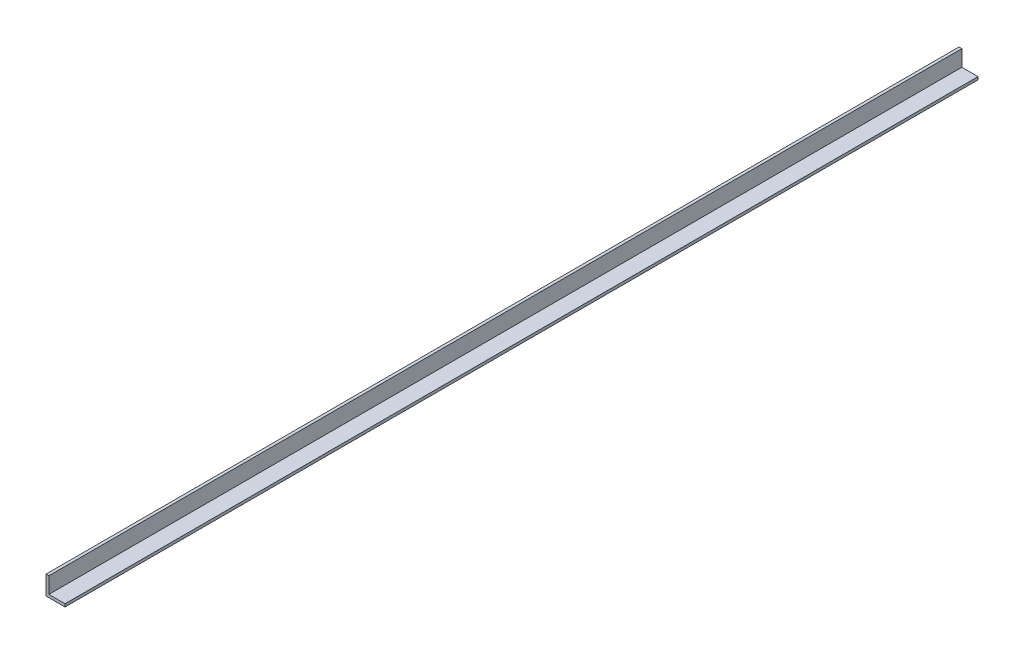
from build123d import *

# Parameters (mm, degrees)
SALIENTE_EXTRUIR1_DEPTH = 6100


with BuildPart() as part:
    # Croquis1 → Saliente-Extruir1 (new body)
    with BuildSketch(Plane.XY):
        Polygon((0, 127), (0, 0), (127, 0), (127, 19.05), (19.05, 19.05), (19.05, 127), align=None)
    extrude(amount=-SALIENTE_EXTRUIR1_DEPTH)


solid = part.part
